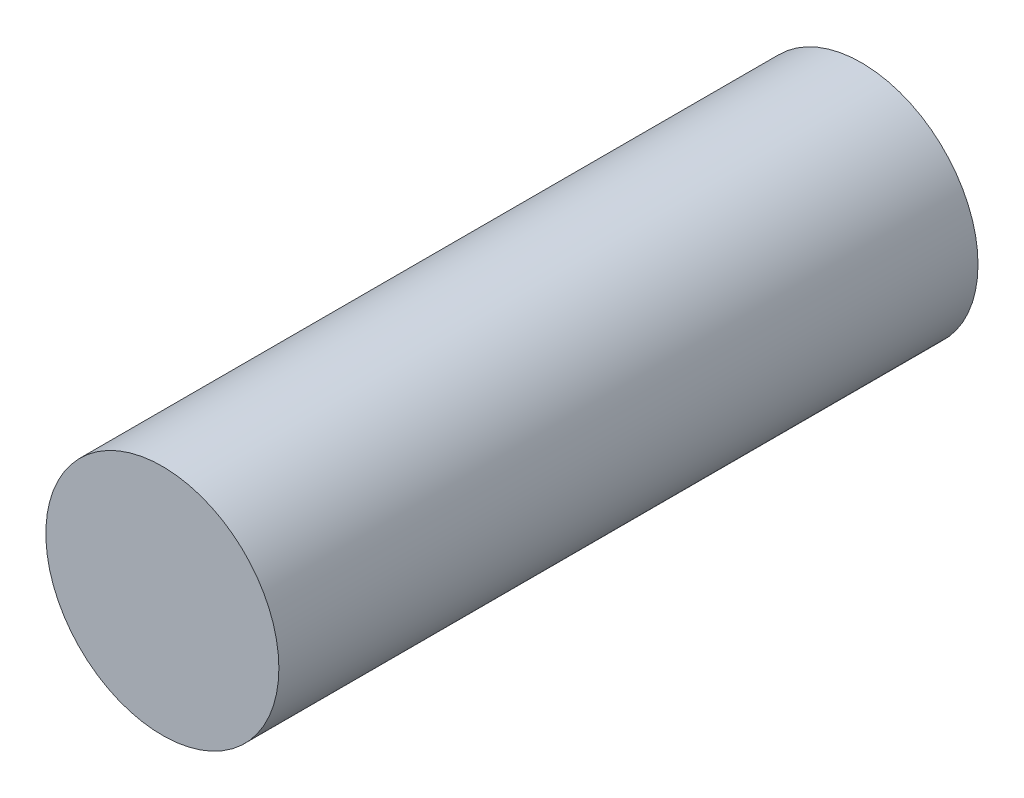
from build123d import *

# Parameters (mm, degrees)
SKETCH1_R           = 7.9375
BOSS_EXTRUDE1_DEPTH = 47.625


with BuildPart() as part:
    # Sketch1 → Boss-Extrude1 (new body)
    with BuildSketch(Plane.XY):
        Circle(SKETCH1_R)
    extrude(amount=BOSS_EXTRUDE1_DEPTH)


solid = part.part
